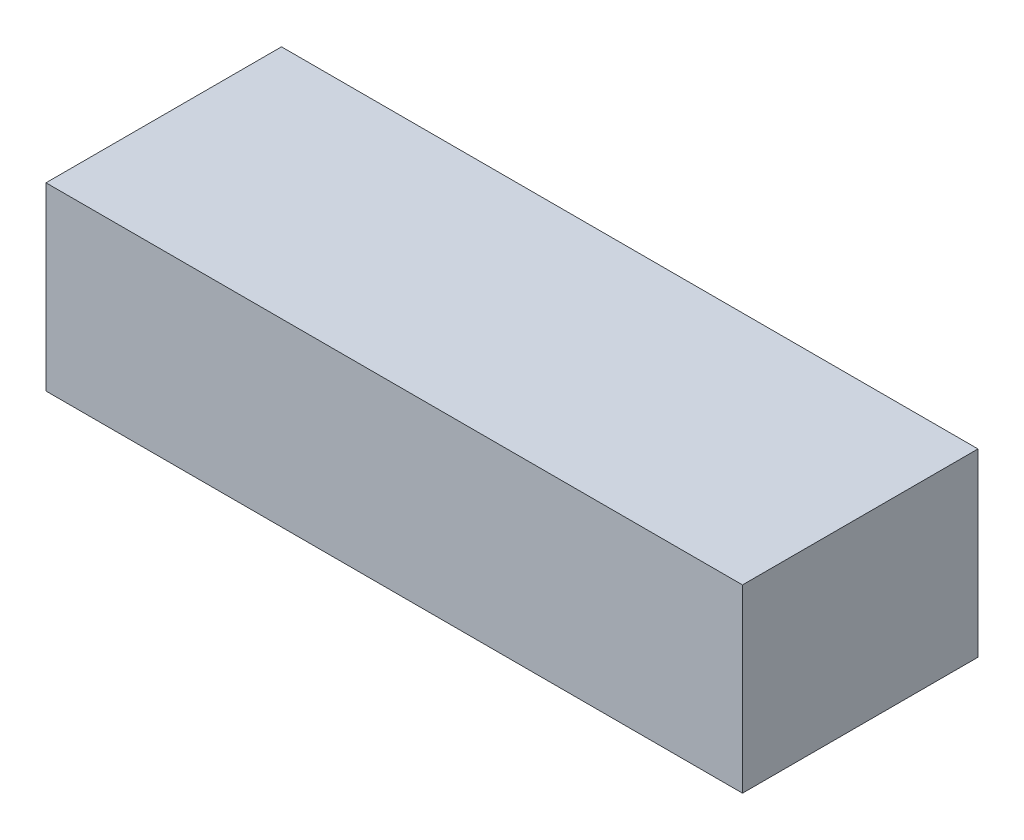
from build123d import *

# Parameters (mm, degrees)
SKETCH1_W           = 139
SKETCH1_H           = 47
BOSS_EXTRUDE1_DEPTH = 36
SKETCH2_W           = 3.441292391
SKETCH2_H           = 12.114310201
CUT_EXTRUDE1_DEPTH  = 18


with BuildPart() as part:
    # Sketch1 → Boss-Extrude1 (new body)
    with BuildSketch(Plane(origin=(0, 0, 0), x_dir=(1, 0, 0), z_dir=(0, 1, 0))):
        Rectangle(SKETCH1_W, SKETCH1_H)
    extrude(amount=BOSS_EXTRUDE1_DEPTH)

    # Sketch2 → Cut-Extrude1 (cut)
    with BuildSketch(Plane.ZY.offset(69.5)):
        with Locations((-21.779353805, 17.833070529)):
            Rectangle(SKETCH2_W, SKETCH2_H)
    extrude(amount=-CUT_EXTRUDE1_DEPTH, mode=Mode.SUBTRACT)


solid = part.part
